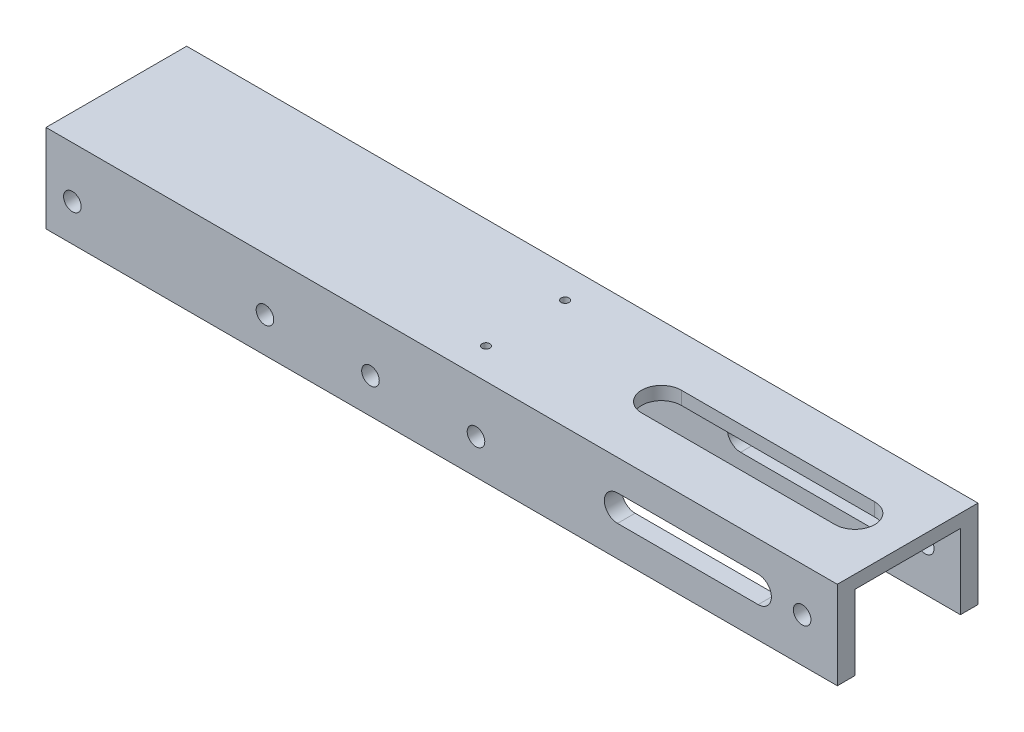
from build123d import *

# Parameters (mm, degrees)
BOSS_EXTRUDE1_DEPTH = 285.75
SKETCH2_R           = 3.175
CUT_EXTRUDE1_DEPTH  = 292.961923887
SKETCH3_R           = 1.4224
CUT_EXTRUDE2_DEPTH  = 6.35
SKETCH4_R           = 3.175
CUT_EXTRUDE3_DEPTH  = 292.961923887


with BuildPart() as part:
    # Sketch1 → Boss-Extrude1 (new body)
    with BuildSketch(Plane(origin=(0, 0, 0), x_dir=(0, 0, -1), z_dir=(1, 0, 0))):
        Polygon((-19.05, -31.75), (-19.05, -4.7625), (19.05, -4.7625), (19.05, -31.75), (25.4, -31.75), (25.4, 0), (-25.4, 0), (-25.4, -31.75), align=None)
    extrude(amount=BOSS_EXTRUDE1_DEPTH)

    # Sketch2 → Cut-Extrude1 (cut, through all)
    with BuildSketch(Plane.XY.offset(25.4)):
        with Locations((9.525, -18.415)):
            Circle(SKETCH2_R)
        with Locations((79.068028046, -19.05)):
            Circle(SKETCH2_R)
        with Locations((117.168028046, -19.05)):
            Circle(SKETCH2_R)
        with Locations((155.268028046, -19.05)):
            Circle(SKETCH2_R)
        with BuildLine():
            Line((206.375, -11.1125), (257.175, -11.1125))
            ThreePointArc((257.175, -11.1125), (261.9375, -15.875), (257.175, -20.6375))
            Line((257.175, -20.6375), (206.375, -20.6375))
            ThreePointArc((206.375, -20.6375), (201.6125, -15.875), (206.375, -11.1125))
        make_face()
    extrude(amount=-CUT_EXTRUDE1_DEPTH, mode=Mode.SUBTRACT)

    # Sketch3 → Cut-Extrude2 (cut)
    with BuildSketch(Plane(origin=(0, 0, 0), x_dir=(1, 0, 0), z_dir=(0, 1, 0))):
        with Locations(Location((147.7645, 14.2875, 0), (0, 0, 270))):
            Circle(SKETCH3_R)
        with Locations(Location((147.7645, -14.2875, 0), (0, 0, 270))):
            Circle(SKETCH3_R)
        with BuildLine():
            Line((196.85, 7.14375), (266.7, 7.14375))
            ThreePointArc((266.7, 7.14375), (273.84375, 0), (266.7, -7.14375))
            Line((266.7, -7.14375), (196.85, -7.14375))
            ThreePointArc((196.85, -7.14375), (189.70625, 0), (196.85, 7.14375))
        make_face()
    extrude(amount=-CUT_EXTRUDE2_DEPTH, mode=Mode.SUBTRACT)

    # Sketch4 → Cut-Extrude3 (cut, through all)
    with BuildSketch(Plane.XY.offset(25.4)):
        with Locations((273.05, -15.875)):
            Circle(SKETCH4_R)
    extrude(amount=-CUT_EXTRUDE3_DEPTH, mode=Mode.SUBTRACT)


solid = part.part
